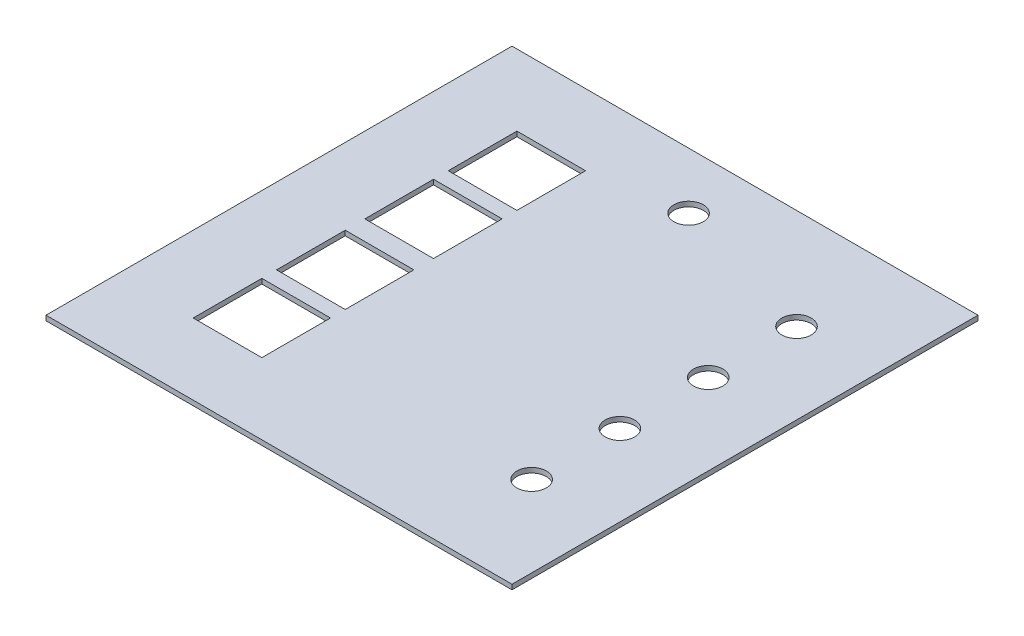
from build123d import *

# Parameters (mm, degrees)
SKETCH1_W           = 95
SKETCH1_H           = 95
BOSS_EXTRUDE1_DEPTH = 1
SKETCH2_R           = 3
SKETCH2_W           = 14
SKETCH2_H           = 14
CUT_EXTRUDE1_DEPTH  = 1


with BuildPart() as part:
    # Sketch1 → Boss-Extrude1 (new body)
    with BuildSketch(Plane(origin=(0, 0, 0), x_dir=(1, 0, 0), z_dir=(0, 1, 0))):
        with Locations((47.5, 47.5)):
            Rectangle(SKETCH1_W, SKETCH1_H)
    extrude(amount=BOSS_EXTRUDE1_DEPTH)

    # Sketch2 → Cut-Extrude1 (cut)
    with BuildSketch(Plane(origin=(0, 1, 0), x_dir=(1, 0, 0), z_dir=(0, 1, 0))):
        with Locations(Location((47.5, 83.5, 0), (0, 0, 270))):
            Circle(SKETCH2_R)
        with Locations(Location((78.5, 74.5, 0), (0, 0, 270))):
            Circle(SKETCH2_R)
        with Locations(Location((78.5, 56.5, 0), (0, 0, 270))):
            Circle(SKETCH2_R)
        with Locations(Location((78.5, 38.5, 0), (0, 0, 90))):
            Circle(SKETCH2_R)
        with Locations(Location((78.5, 20.5, 0), (0, 0, 90))):
            Circle(SKETCH2_R)
        with Locations((22.5, 56.5)):
            Rectangle(SKETCH2_W, SKETCH2_H)
        with Locations((22.5, 73.5)):
            Rectangle(SKETCH2_W, SKETCH2_H)
        with Locations((22.5, 21.5)):
            Rectangle(SKETCH2_W, SKETCH2_H)
        with Locations((22.5, 38.5)):
            Rectangle(SKETCH2_W, SKETCH2_H)
    extrude(amount=-CUT_EXTRUDE1_DEPTH, mode=Mode.SUBTRACT)


solid = part.part
